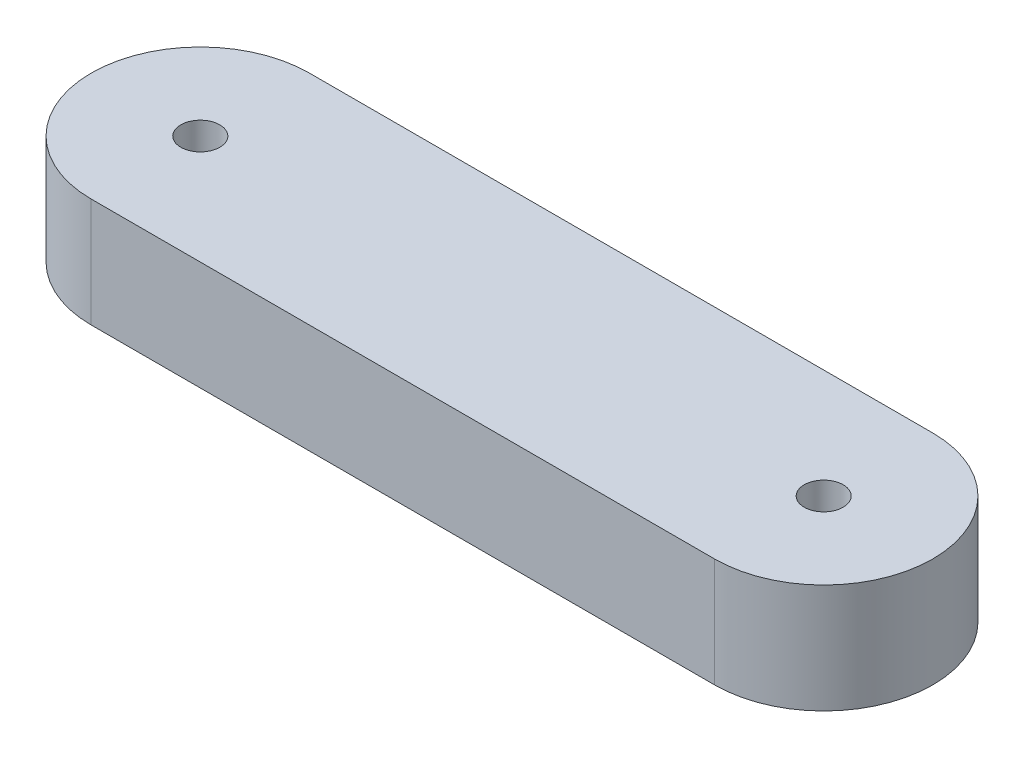
from build123d import *

# Parameters (mm, degrees)
SKETCH1_R           = 3.75
BOSS_EXTRUDE1_DEPTH = 21


with BuildPart() as part:
    # Sketch1 → Boss-Extrude1 (new body)
    with BuildSketch(Plane(origin=(0, 0, 0), x_dir=(1, 0, 0), z_dir=(0, 1, 0))):
        with BuildLine():
            Line((0, 21), (120, 21))
            ThreePointArc((120, 21), (141, 0), (120, -21))
            Line((120, -21), (0, -21))
            ThreePointArc((0, -21), (-21, 0), (0, 21))
        make_face()
        with Locations(Location((0, 0, 0), (0, 0, 90))):
            Circle(SKETCH1_R, mode=Mode.SUBTRACT)
        with Locations(Location((120, 0, 0), (0, 0, 90))):
            Circle(SKETCH1_R, mode=Mode.SUBTRACT)
    extrude(amount=BOSS_EXTRUDE1_DEPTH)


solid = part.part
